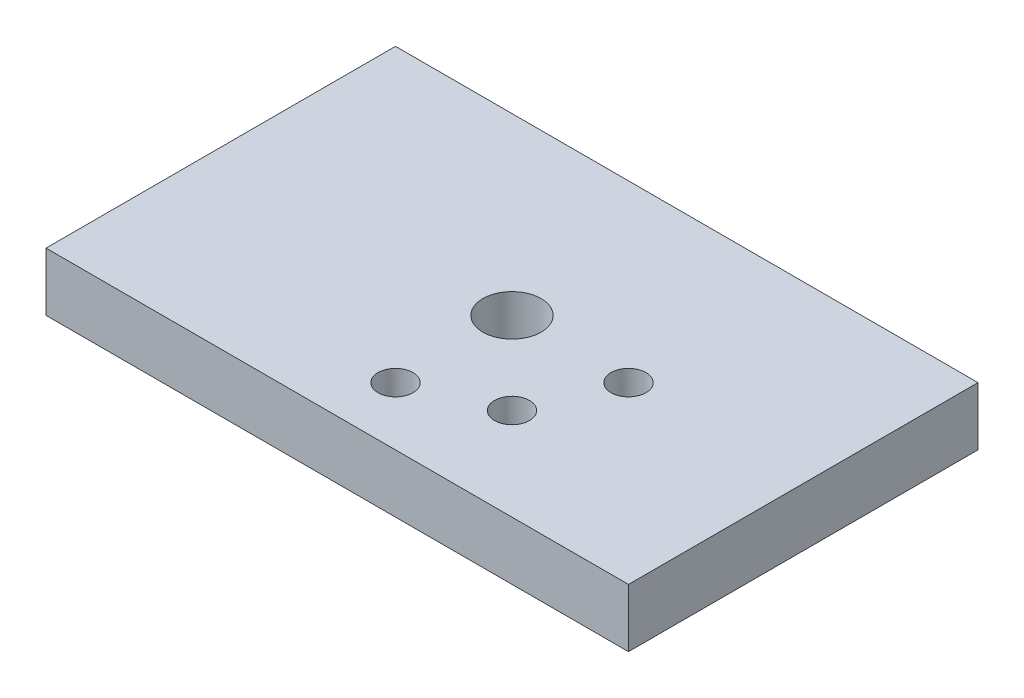
from build123d import *

# Parameters (mm, degrees)
SKETCH_1_W               = 100
SKETCH_1_H               = 60
EXTRUDE_1_DEPTH          = 10
SKETCH_2_R               = 5
CUT_EXTRUDE_1_DEPTH      = 20
SKETCH_3_R               = 3
CUT_EXTRUDE_2_DEPTH      = 20
PATTERN_CIRCULAR_1_COUNT = 3
PATTERN_CIRCULAR_1_ANGLE = 90


with BuildPart() as part:
    # 草图1 → 凸台-拉伸1 (new body)
    with BuildSketch(Plane(origin=(0, 0, 0), x_dir=(1, 0, 0), z_dir=(0, 1, 0))):
        Rectangle(SKETCH_1_W, SKETCH_1_H)
    extrude(amount=EXTRUDE_1_DEPTH)

    # 草图2 → 切除-拉伸1 (cut)
    with BuildSketch(Plane(origin=(0, 0, 0), x_dir=(1, 0, 0), z_dir=(0, 1, 0))):
        with Locations(Location((0, 0, 0), (0, 0, 90))):
            Circle(SKETCH_2_R)
    extrude(amount=CUT_EXTRUDE_1_DEPTH, mode=Mode.SUBTRACT)

    # 草图3 → 切除-拉伸2 (cut)
    with BuildSketch(Plane(origin=(0, 0, 0), x_dir=(1, 0, 0), z_dir=(0, 1, 0))):
        with Locations(Location((20, 0, 0), (0, 0, 90))):
            Circle(SKETCH_3_R)
    cut_extrude_2 = extrude(amount=CUT_EXTRUDE_2_DEPTH, mode=Mode.SUBTRACT)

    # 阵列(圆周)1: 切除-拉伸2 ×3 about axis
    pattern_circular_1_axis = Axis((0, 0, 0), (0, -1, 0))
    for i in range(1, PATTERN_CIRCULAR_1_COUNT):
        add(cut_extrude_2.rotate(pattern_circular_1_axis, i * PATTERN_CIRCULAR_1_ANGLE / (PATTERN_CIRCULAR_1_COUNT - 1)), mode=Mode.SUBTRACT)


solid = part.part
